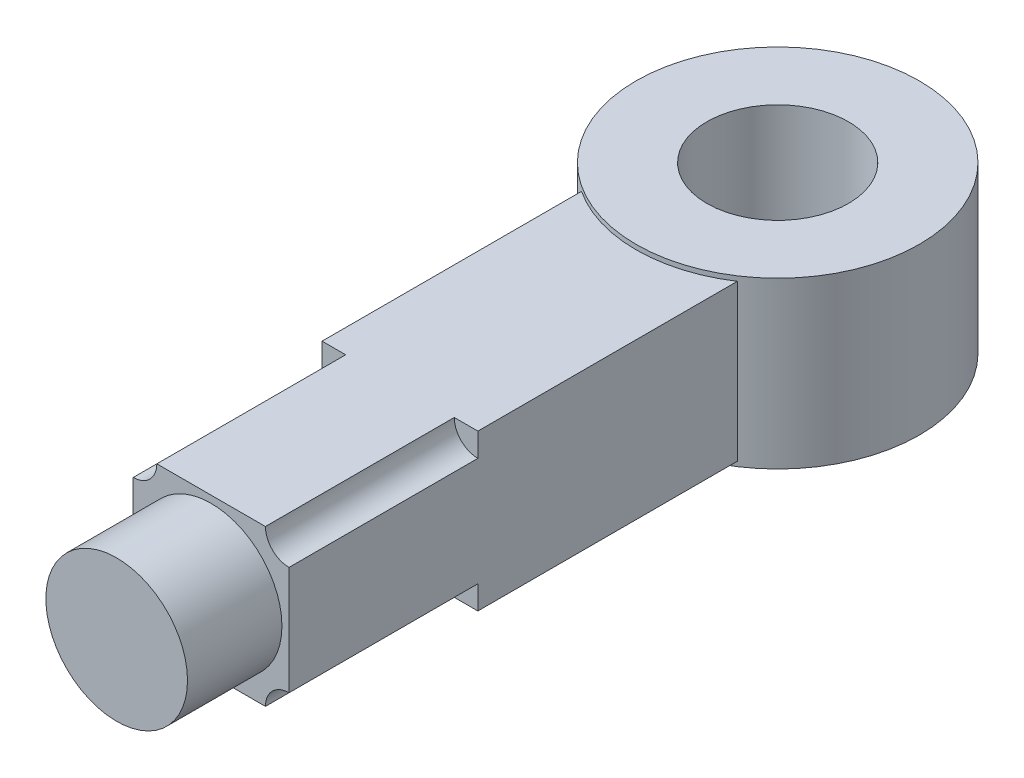
from build123d import *

# Parameters (mm, degrees)
SKETCH1_R           = 30
BOSS_EXTRUDE1_DEPTH = 17.5
SKETCH2_W           = 33
SKETCH2_H           = 33
BOSS_EXTRUDE2_DEPTH = 120
SKETCH3_R           = 15
BOSS_EXTRUDE3_DEPTH = 20
CUT_EXTRUDE1_START  = -40
CUT_EXTRUDE1_DEPTH  = 194.968340902
CIRPATTERN1_COUNT   = 4
HOLE1_D             = 30


with BuildPart() as part:
    # Sketch1 → Boss-Extrude1 (new, symmetric)
    with BuildSketch(Plane(origin=(0, 0, 0), x_dir=(1, 0, 0), z_dir=(0, 1, 0))):
        with Locations(Location((0, 0, 0), (0, 0, 270))):
            Circle(SKETCH1_R)
    extrude(amount=BOSS_EXTRUDE1_DEPTH, both=True)

    # Sketch2 → Boss-Extrude2 (add)
    with BuildSketch(Plane.XY):
        Rectangle(SKETCH2_W, SKETCH2_H)
    extrude(amount=BOSS_EXTRUDE2_DEPTH)

    # Sketch3 → Boss-Extrude3 (add)
    with BuildSketch(Plane.XY.offset(120)):
        Circle(SKETCH3_R)
    extrude(amount=BOSS_EXTRUDE3_DEPTH)

    # Sketch4 → Cut-Extrude1 (cut)
    with BuildSketch(Plane.XY.offset(120).offset(CUT_EXTRUDE1_START)):
        with BuildLine():
            Line((16.5, 11.5), (16.5, 16.5))
            Line((16.5, 16.5), (11.5, 16.5))
            ThreePointArc((11.5, 16.5), (12.964466094, 12.964466094), (16.5, 11.5))
        make_face()
    cut_extrude1 = extrude(amount=CUT_EXTRUDE1_DEPTH, mode=Mode.SUBTRACT)

    # CirPattern1: Cut-Extrude1 ×4 about axis
    cirpattern1_axis = Axis((0, 0, 0), (0, 0, 1))
    for i in range(1, CIRPATTERN1_COUNT):
        add(cut_extrude1.rotate(cirpattern1_axis, i * 360 / CIRPATTERN1_COUNT), mode=Mode.SUBTRACT)

    # Hole1 (through all)
    with Locations(Plane(origin=(0, 17.5, 0), x_dir=(1, 0, 0), z_dir=(0, 1, 0))):
        with Locations((0, 0)):
            Hole(HOLE1_D / 2)


solid = part.part
